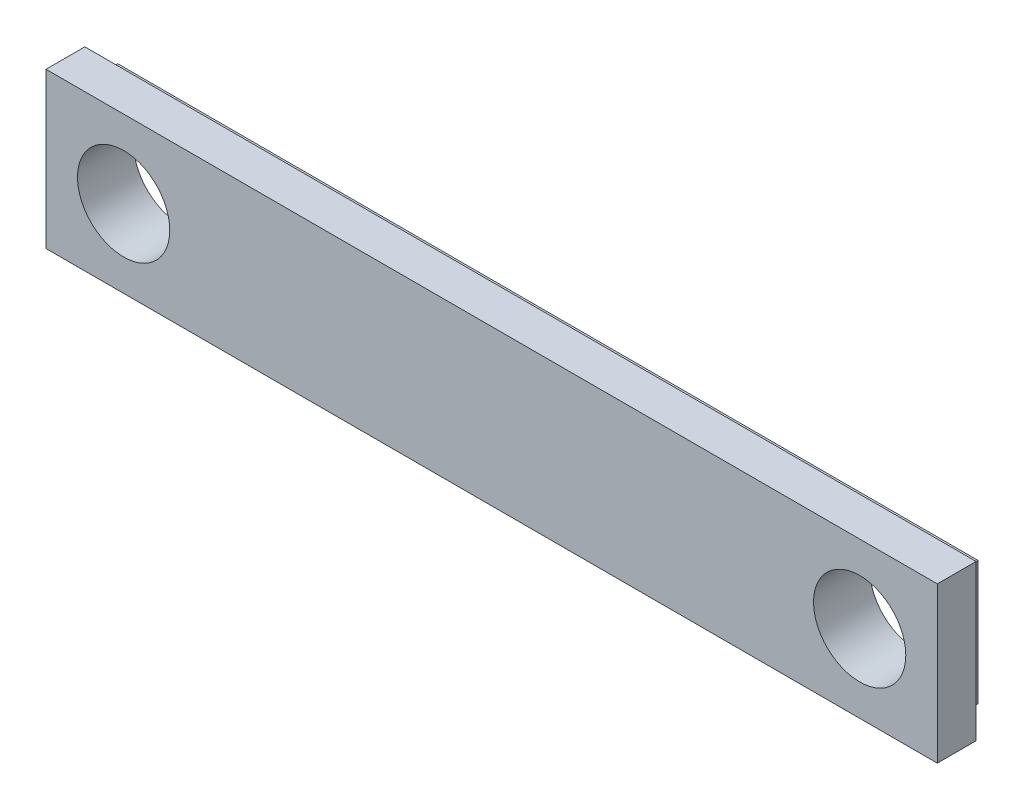
from build123d import *

# Parameters (mm, degrees)
SKETCH1_W           = 55.4
SKETCH1_H           = 8
SKETCH1_R           = 2.97
BOSS_EXTRUDE1_DEPTH = 1.12
SKETCH2_W           = 57.4
SKETCH2_H           = 10
SKETCH2_R           = 2.97
BOSS_EXTRUDE2_DEPTH = 2.5


with BuildPart() as part:
    # Sketch1 → Boss-Extrude1 (new body)
    with BuildSketch(Plane.XY.offset(0.931976945)):
        with Locations((189.6, 6)):
            Rectangle(SKETCH1_W, SKETCH1_H)
        with Locations((165.9, 6)):
            Circle(SKETCH1_R, mode=Mode.SUBTRACT)
        with Locations((213.3, 6)):
            Circle(SKETCH1_R, mode=Mode.SUBTRACT)
    extrude(amount=BOSS_EXTRUDE1_DEPTH)

    # Sketch2 → Boss-Extrude2 (add)
    with BuildSketch(Plane.XY.offset(2.051976945)):
        with Locations((189.6, 6)):
            Rectangle(SKETCH2_W, SKETCH2_H)
        with Locations((213.3, 6)):
            Circle(SKETCH2_R, mode=Mode.SUBTRACT)
        with Locations((165.9, 6)):
            Circle(SKETCH2_R, mode=Mode.SUBTRACT)
    extrude(amount=BOSS_EXTRUDE2_DEPTH)


solid = part.part
